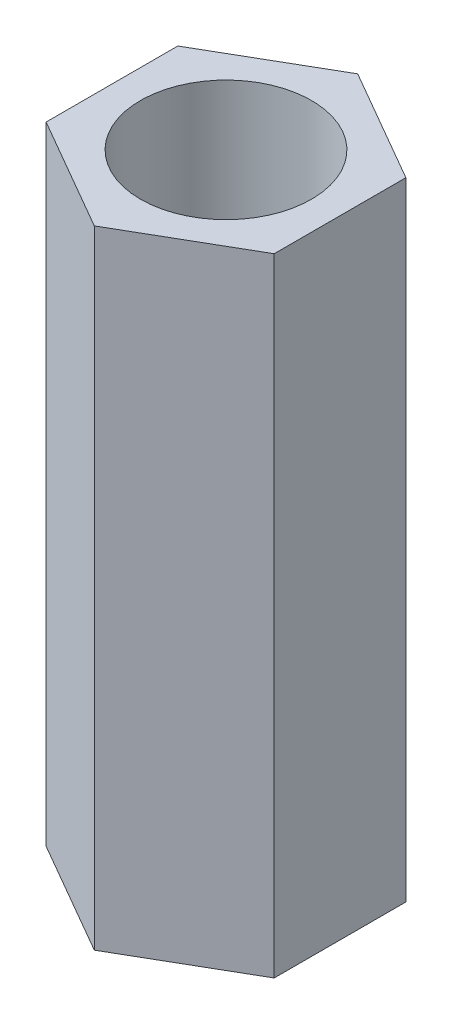
from build123d import *

# Parameters (mm, degrees)
SKETCH_1_R      = 1.5
EXTRUDE_1_DEPTH = 11


with BuildPart() as part:
    # 草图1 → 凸台-拉伸1 (new body)
    with BuildSketch(Plane(origin=(0, 0, 0), x_dir=(1, 0, 0), z_dir=(0, 1, 0))):
        Polygon((0, 2.309401077), (-2, 1.154700538), (-2, -1.154700538), (0, -2.309401077), (2, -1.154700538), (2, 1.154700538), align=None)
        with Locations(Location((0, 0, 0), (0, 0, 270))):
            Circle(SKETCH_1_R, mode=Mode.SUBTRACT)
    extrude(amount=EXTRUDE_1_DEPTH)


solid = part.part
